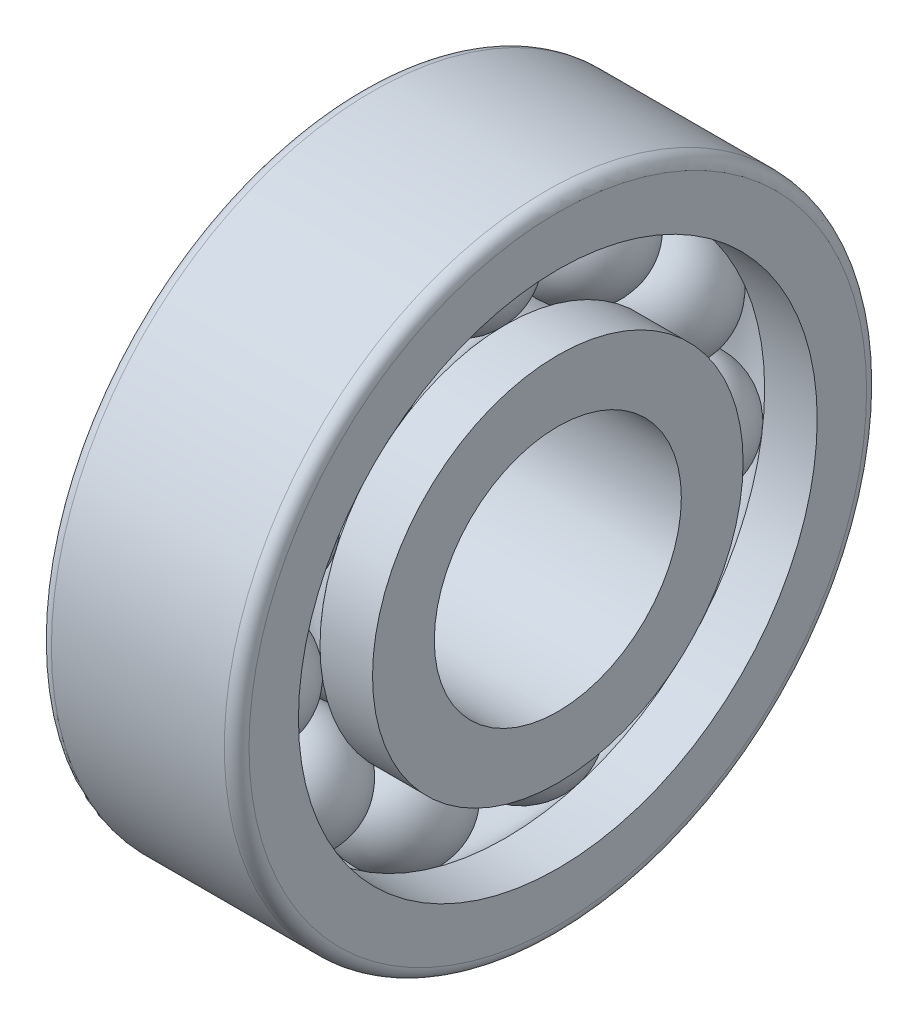
from build123d import *

# Parameters (mm, degrees)
R_P_TITION_CIRCULAIRE1_COUNT = 11
CONG_1_R                     = 0.5


with BuildPart() as part:
    # Esquisse1 → Révolution1 (revolve)
    with BuildSketch(Plane.XY, mode=Mode.PRIVATE) as r_volution1_sk:
        with BuildLine():
            ThreePointArc((-5.8734994, 7.5), (-4, 6.6), (-2.1265006, 7.5))
            Line((-2.1265006, 7.5), (0, 7.5))
            Line((0, 7.5), (0, 5))
            Line((0, 5), (-8, 5))
            Line((-8, 5), (-8, 7.5))
            Line((-8, 7.5), (-5.8734994, 7.5))
        make_face()
        with BuildLine():
            ThreePointArc((-2.1265006, 10.5), (-4, 11.4), (-5.8734994, 10.5))
            Line((-5.8734994, 10.5), (-8, 10.5))
            Line((-8, 10.5), (-8, 13))
            Line((-8, 13), (0, 13))
            Line((0, 13), (0, 10.5))
            Line((0, 10.5), (-2.1265006, 10.5))
        make_face()
    revolve(r_volution1_sk.sketch.rotate(Axis((0, 0, 0), (-1, 0, 0)), 90), axis=Axis((0, 0, 0), (-1, 0, 0)))

    # Congé1
    cong_1_edges = [part.edges().sort_by_distance(p)[0] for p in [
        (-8, 0, 13),
        (0, 0, 13),
    ]]
    fillet(cong_1_edges, radius=CONG_1_R)


with BuildPart() as body_2:
    # Esquisse2 → Révolution2 (revolve)
    with BuildSketch(Plane.XY):
        with BuildLine():
            Line((-1.6, 9), (-4, 9))
            Line((-4, 9), (-6.4, 9))
            ThreePointArc((-6.4, 9), (-4, 11.4), (-1.6, 9))
        make_face()
    revolve(axis=Axis((-7.595195311, 9, 0), (1, 0, 0)))


with BuildPart() as r_p_tition_circulaire1_1:
    # Répétition circulaire1: pattern copy
    add(body_2.part.rotate(Axis((0, 0, 0), (1, 0, 0)), 1 * 360 / R_P_TITION_CIRCULAIRE1_COUNT))


with BuildPart() as r_p_tition_circulaire1_2:
    # Répétition circulaire1: pattern copy
    add(body_2.part.rotate(Axis((0, 0, 0), (1, 0, 0)), 2 * 360 / R_P_TITION_CIRCULAIRE1_COUNT))


with BuildPart() as r_p_tition_circulaire1_3:
    # Répétition circulaire1: pattern copy
    add(body_2.part.rotate(Axis((0, 0, 0), (1, 0, 0)), 3 * 360 / R_P_TITION_CIRCULAIRE1_COUNT))


with BuildPart() as r_p_tition_circulaire1_4:
    # Répétition circulaire1: pattern copy
    add(body_2.part.rotate(Axis((0, 0, 0), (1, 0, 0)), 4 * 360 / R_P_TITION_CIRCULAIRE1_COUNT))


with BuildPart() as r_p_tition_circulaire1_5:
    # Répétition circulaire1: pattern copy
    add(body_2.part.rotate(Axis((0, 0, 0), (1, 0, 0)), 5 * 360 / R_P_TITION_CIRCULAIRE1_COUNT))


with BuildPart() as r_p_tition_circulaire1_6:
    # Répétition circulaire1: pattern copy
    add(body_2.part.rotate(Axis((0, 0, 0), (1, 0, 0)), 6 * 360 / R_P_TITION_CIRCULAIRE1_COUNT))


with BuildPart() as r_p_tition_circulaire1_7:
    # Répétition circulaire1: pattern copy
    add(body_2.part.rotate(Axis((0, 0, 0), (1, 0, 0)), 7 * 360 / R_P_TITION_CIRCULAIRE1_COUNT))


with BuildPart() as r_p_tition_circulaire1_8:
    # Répétition circulaire1: pattern copy
    add(body_2.part.rotate(Axis((0, 0, 0), (1, 0, 0)), 8 * 360 / R_P_TITION_CIRCULAIRE1_COUNT))


with BuildPart() as r_p_tition_circulaire1_9:
    # Répétition circulaire1: pattern copy
    add(body_2.part.rotate(Axis((0, 0, 0), (1, 0, 0)), 9 * 360 / R_P_TITION_CIRCULAIRE1_COUNT))


with BuildPart() as r_p_tition_circulaire1_10:
    # Répétition circulaire1: pattern copy
    add(body_2.part.rotate(Axis((0, 0, 0), (1, 0, 0)), 10 * 360 / R_P_TITION_CIRCULAIRE1_COUNT))


solid = Compound([part.part, body_2.part, r_p_tition_circulaire1_1.part, r_p_tition_circulaire1_2.part, r_p_tition_circulaire1_3.part, r_p_tition_circulaire1_4.part, r_p_tition_circulaire1_5.part, r_p_tition_circulaire1_6.part, r_p_tition_circulaire1_7.part, r_p_tition_circulaire1_8.part, r_p_tition_circulaire1_9.part, r_p_tition_circulaire1_10.part])
